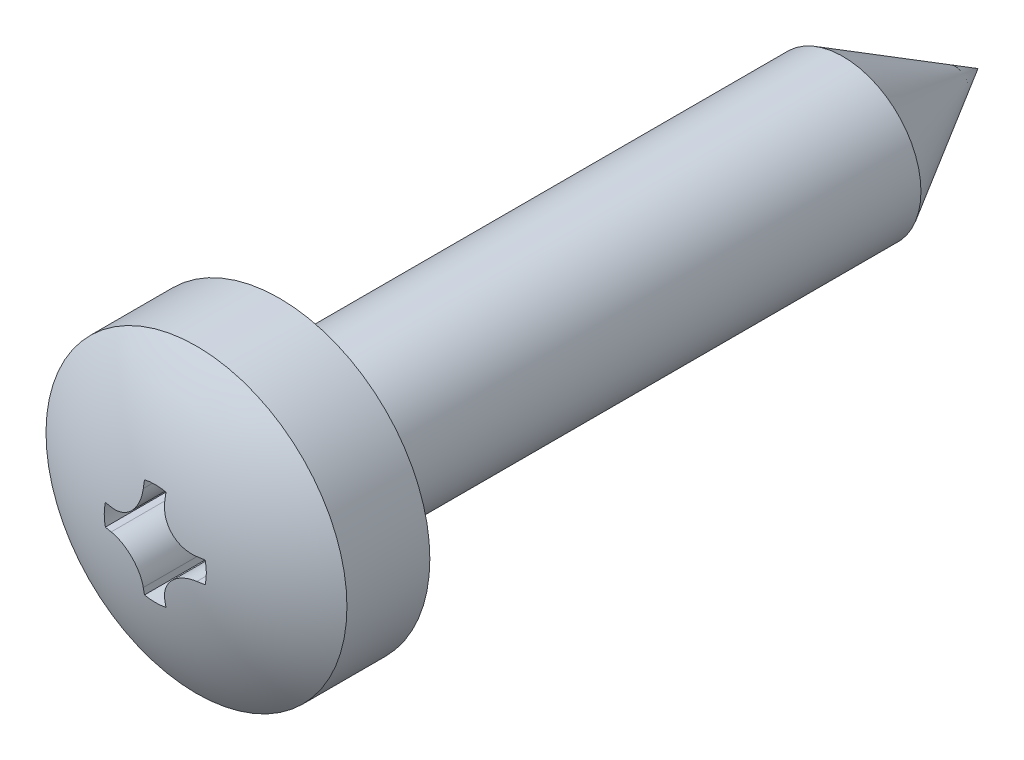
from build123d import *

# Parameters (mm, degrees)
CUT_EXTRUDE_2_DEPTH = 1.2
FILLET_1_R          = 0.1


with BuildPart() as part:
    # 草图8 → Revolve 1542 (revolve)
    with BuildSketch(Plane(origin=(0, 0, 0), x_dir=(0, 0, -1), z_dir=(1, 0, 0)), mode=Mode.PRIVATE) as revolve_1542_sk:
        with BuildLine():
            Line((0, 0), (-15.4, 0))
            ThreePointArc((-15.4, 0), (-15.180811394, 1.464186604), (-14.542463035, 2.8))
            Line((-14.542463035, 2.8), (-13, 2.8))
            Line((-13, 2.8), (-13, 1.45))
            Line((-13, 1.45), (-2.511473671, 1.45))
            Line((-2.511473671, 1.45), (0, 0))
        make_face()
    revolve(revolve_1542_sk.sketch.rotate(Axis((0, 0, 11.71), (0, 0, -1)), 90), axis=Axis((0, 0, 11.71), (0, 0, -1)))

    # 草图7 → 切除-拉伸2 (cut)
    with BuildSketch(Plane.XY.offset(15.4)):
        with BuildLine():
            Line((0.2, 0.928708781), (0.2, 0.797500009))
            ThreePointArc((0.2, 0.797500009), (0.375003701, 0.375003701), (0.797500009, 0.2))
            Line((0.797500009, 0.2), (0.928708781, 0.2))
            ThreePointArc((0.928708781, 0.2), (0.95, 0), (0.928708781, -0.2))
            Line((0.928708781, -0.2), (0.797500009, -0.2))
            ThreePointArc((0.797500009, -0.2), (0.375003701, -0.375003701), (0.2, -0.797500009))
            Line((0.2, -0.797500009), (0.2, -0.928708781))
            ThreePointArc((0.2, -0.928708781), (0, -0.95), (-0.2, -0.928708781))
            Line((-0.2, -0.928708781), (-0.2, -0.797500009))
            ThreePointArc((-0.2, -0.797500009), (-0.375003701, -0.375003701), (-0.797500009, -0.2))
            Line((-0.797500009, -0.2), (-0.928708781, -0.2))
            ThreePointArc((-0.928708781, -0.2), (-0.95, 0), (-0.928708781, 0.2))
            Line((-0.928708781, 0.2), (-0.797500009, 0.2))
            ThreePointArc((-0.797500009, 0.2), (-0.375003701, 0.375003701), (-0.2, 0.797500009))
            Line((-0.2, 0.797500009), (-0.2, 0.928708781))
            ThreePointArc((-0.2, 0.928708781), (0, 0.95), (0.2, 0.928708781))
        make_face()
    extrude(amount=-CUT_EXTRUDE_2_DEPTH, mode=Mode.SUBTRACT)

    # 圆角1
    fillet_1_edges = [part.edges().sort_by_distance(p)[0] for p in [
        (-1.45, 0, 13),
    ]]
    fillet(fillet_1_edges, radius=FILLET_1_R)


solid = part.part
